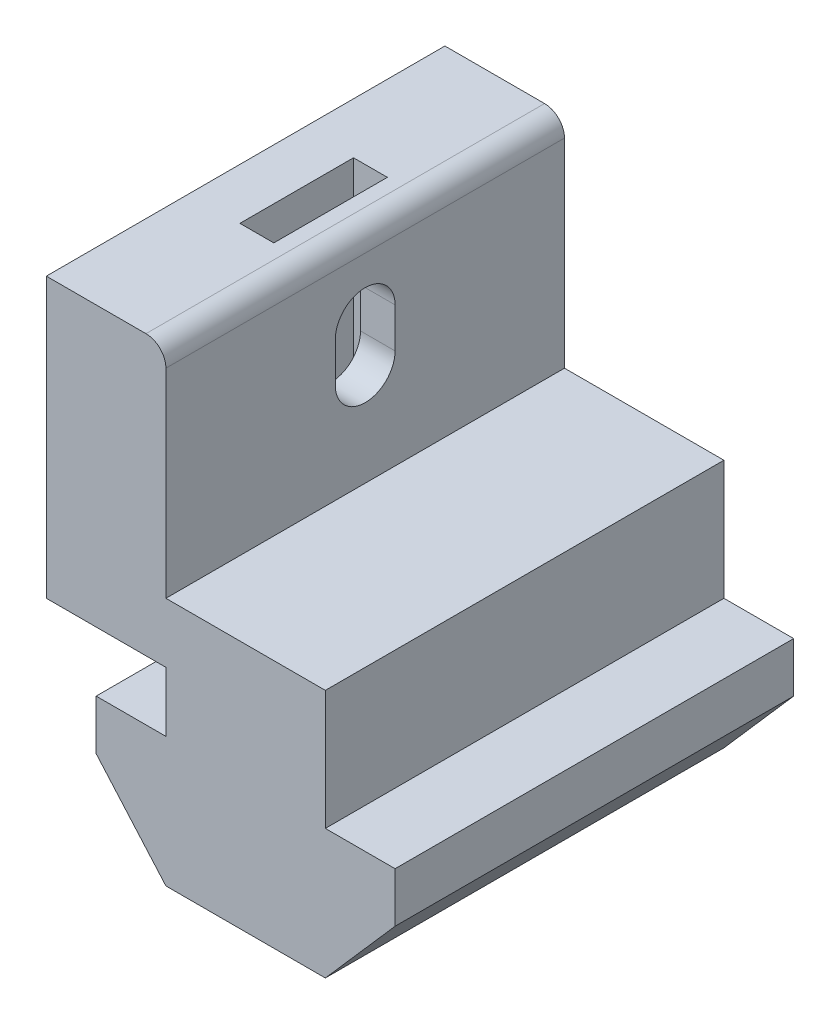
from build123d import *

# Parameters (mm, degrees)
ESTRUSIONE_ESTRUSIONE1_DEPTH = 20
TAGLIO_ESTRUSIONE1_REACH     = 37.475
ESTRUSIONE_ESTRUSIONE4_DEPTH = 0.6
SCHIZZO12_W                  = 1.7
SCHIZZO12_H                  = 5.7
TAGLIO_ESTRUSIONE2_DEPTH     = 10


with BuildPart() as part:
    # Schizzo2 → Estrusione-Estrusione1 (new body)
    with BuildSketch(Plane.XY):
        with BuildLine():
            Line((-4, 9.5), (-10, 9.5))
            Line((-10, 9.5), (-10, 23.5))
            Line((-10, 23.5), (-5, 23.5))
            ThreePointArc((-5, 23.5), (-4.292893219, 23.207106781), (-4, 22.5))
            Line((-4, 22.5), (-4, 12.5))
            Line((-4, 12.5), (4, 12.5))
            Line((4, 12.5), (4, 9.5))
            Line((4, 9.5), (4, 6.5))
            Line((4, 6.5), (7.5, 6.5))
            Line((7.5, 6.5), (7.5, 4))
            Line((7.5, 4), (4, 0))
            Line((4, 0), (-4, 0))
            Line((-4, 0), (-7.5, 4))
            Line((-7.5, 4), (-7.5, 6.5))
            Line((-7.5, 6.5), (-4, 6.5))
            Line((-4, 6.5), (-4, 9.5))
        make_face()
    extrude(amount=-ESTRUSIONE_ESTRUSIONE1_DEPTH)

    # Schizzo6 → Taglio-Estrusione1 (cut, up to next)
    with BuildSketch(Plane.ZY.offset(10), mode=Mode.PRIVATE) as taglio_estrusione1_sk1:
        with BuildLine():
            Line((-8.5, 19.5), (-8.5, 17.5))
            ThreePointArc((-8.5, 17.5), (-10, 16), (-11.5, 17.5))
            Line((-11.5, 17.5), (-11.5, 19.5))
            ThreePointArc((-11.5, 19.5), (-10, 21), (-8.5, 19.5))
        make_face()
    taglio_estrusione1_tool1 = extrude(taglio_estrusione1_sk1.sketch, amount=-TAGLIO_ESTRUSIONE1_REACH, mode=Mode.PRIVATE) & part.part
    add(taglio_estrusione1_tool1.solids().sort_by_distance((-10, 18.5, -10))[0], mode=Mode.SUBTRACT)

    # Schizzo11 → Estrusione-Estrusione4 (add)
    with BuildSketch(Plane(origin=(0, 0, -20), x_dir=(-1, 0, 0), z_dir=(0, 0, -1))):
        Polygon((0.798177083, 7.666666667), (0.916666667, 7.666666667), (0.916666667, 3.166666667), (1.666666667, 3.166666667), (1.666666667, 2.5), (0.916666667, 2.5), (0.916666667, 1), (0.333333333, 1), (0.333333333, 2.5), (-2.75, 2.5), align=None)
        Polygon((0.333333333, 3.166666667), (0.333333333, 5.989583333), (-1.604166667, 3.166666667), align=None, mode=Mode.SUBTRACT)
    extrude(amount=ESTRUSIONE_ESTRUSIONE4_DEPTH)

    # Schizzo12 → Taglio-Estrusione2 (cut)
    with BuildSketch(Plane(origin=(0, 23.5, 0), x_dir=(1, 0, 0), z_dir=(0, 1, 0))):
        with Locations((-6.586432065, 10)):
            Rectangle(SCHIZZO12_W, SCHIZZO12_H)
    extrude(amount=-TAGLIO_ESTRUSIONE2_DEPTH, mode=Mode.SUBTRACT)


solid = part.part
